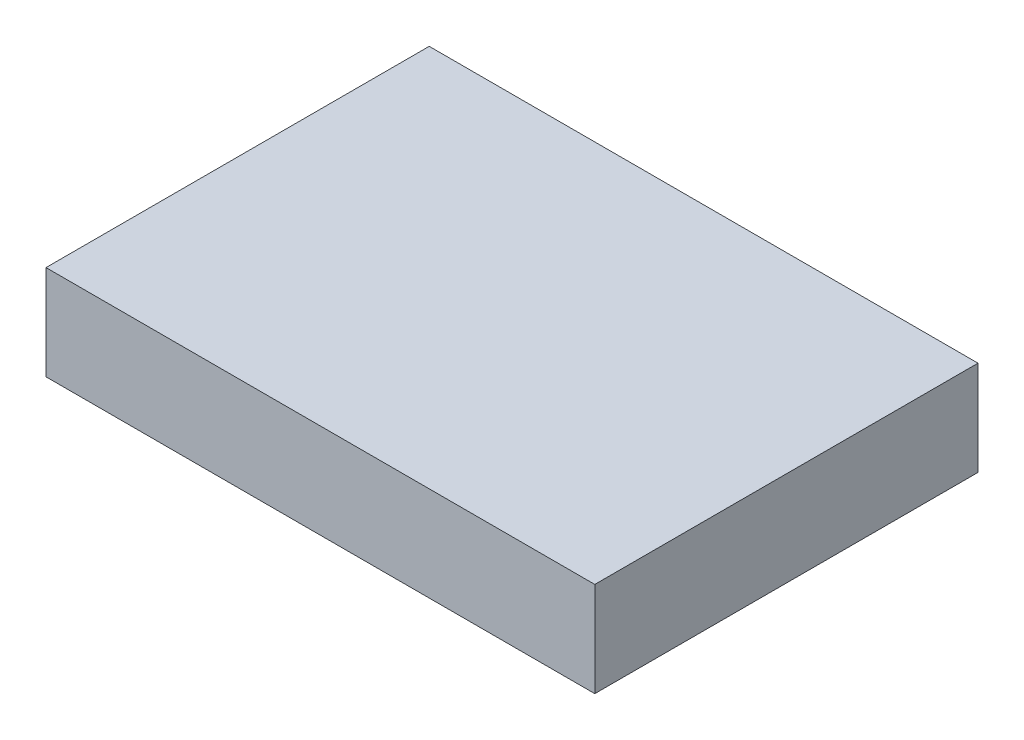
from build123d import *

# Parameters (mm, degrees)
SKETCH1_W           = 116
SKETCH1_H           = 81
BOSS_EXTRUDE1_DEPTH = 20


with BuildPart() as part:
    # Sketch1 → Boss-Extrude1 (new body)
    with BuildSketch(Plane(origin=(0, 0, 0), x_dir=(1, 0, 0), z_dir=(0, 1, 0))):
        Rectangle(SKETCH1_W, SKETCH1_H)
    extrude(amount=BOSS_EXTRUDE1_DEPTH)


solid = part.part
